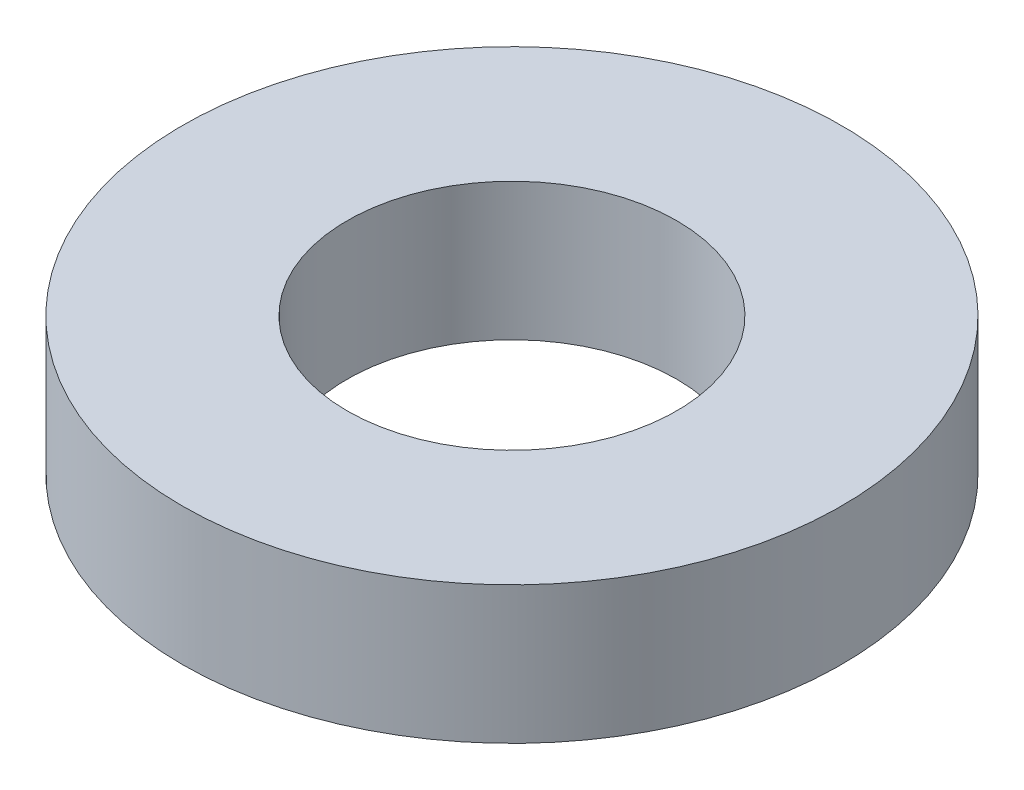
from build123d import *

# Parameters (mm, degrees)
SKETCH1_R           = 12
SKETCH1_R_2         = 6
BOSS_EXTRUDE1_DEPTH = 5


with BuildPart() as part:
    # Sketch1 → Boss-Extrude1 (new body)
    with BuildSketch(Plane(origin=(0, 0, 0), x_dir=(1, 0, 0), z_dir=(0, 1, 0))):
        Circle(SKETCH1_R)
        Circle(SKETCH1_R_2, mode=Mode.SUBTRACT)
    extrude(amount=BOSS_EXTRUDE1_DEPTH)


solid = part.part
